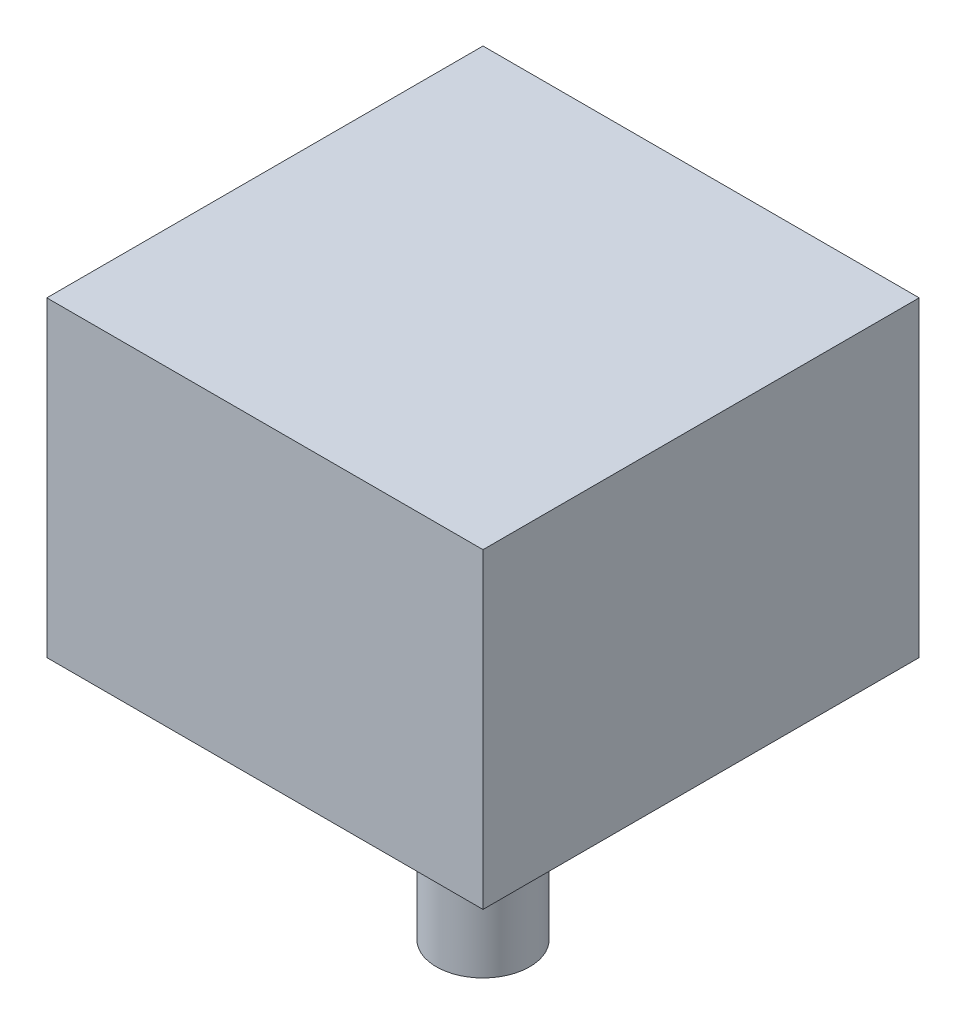
from build123d import *

# Parameters (mm, degrees)
SKETCH1_W               = 28
SKETCH1_H               = 28
BOSS_EXTRUDE1_DEPTH     = 10
CUT_EXTRUDE1_DEPTH      = 41.497142578
CUT_EXTRUDE1_DEPTH_BACK = 41.497142578
SKETCH4_R               = 1.55


with BuildPart() as part:
    # Sketch1 → Boss-Extrude1 (new, symmetric)
    with BuildSketch(Plane(origin=(0, 0, 0), x_dir=(1, 0, 0), z_dir=(0, 1, 0))):
        Rectangle(SKETCH1_W, SKETCH1_H)
    extrude(amount=BOSS_EXTRUDE1_DEPTH, both=True)

    # Sketch2 → Cut-Revolve1 (revolve, cut)
    with BuildSketch(Plane.XY):
        with BuildLine():
            Line((0, -15), (0, -1))
            ThreePointArc((0, -1), (7, -8), (0, -15))
        make_face()
    revolve(axis=Axis((0, -15, 0), (0, 1, 0)), mode=Mode.SUBTRACT)


with BuildPart() as body_2:
    # Sketch3 → Revolve1 (revolve)
    with BuildSketch(Plane.XY, mode=Mode.PRIVATE) as revolve1_sk:
        with BuildLine():
            Line((0, -1), (0, -14.4))
            Line((0, -14.4), (0, -25.69082632))
            Line((0, -25.69082632), (3, -25.69082632))
            Line((3, -25.69082632), (3, -13.69082632))
            ThreePointArc((3, -13.69082632), (6.520296632, -6.158659082), (0, -1))
        make_face()
    revolve(revolve1_sk.sketch.rotate(Axis((0, -15, 0), (0, 1, 0)), 90), axis=Axis((0, -15, 0), (0, 1, 0)))

    # Sketch4 → Cut-Extrude1 (cut, two sides: drawn at the far end of the back side and taken through both)
    with BuildSketch(Plane.XY.offset(14).offset(-CUT_EXTRUDE1_DEPTH_BACK)):
        with Locations((0, -17.69082632)):
            Circle(SKETCH4_R)
    extrude(amount=CUT_EXTRUDE1_DEPTH + CUT_EXTRUDE1_DEPTH_BACK, mode=Mode.SUBTRACT)


solid = Compound([part.part, body_2.part])
